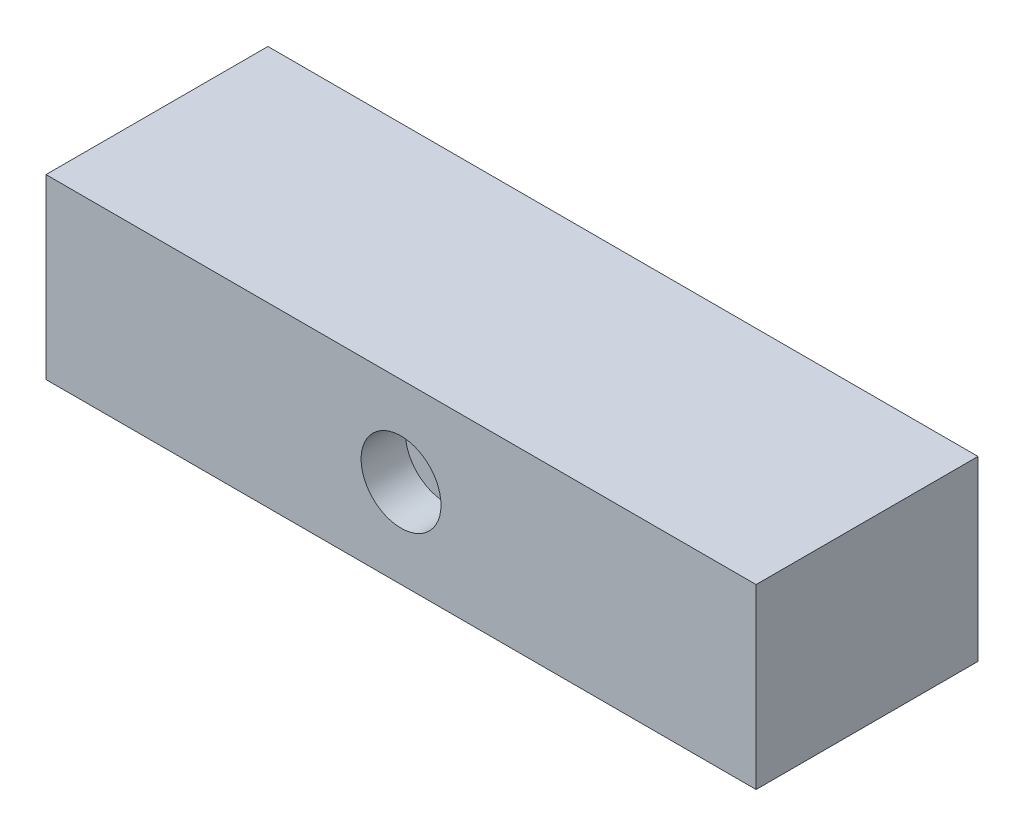
from build123d import *

# Parameters (mm, degrees)
SKETCH1_W           = 40
SKETCH1_H           = 10
BOSS_EXTRUDE1_DEPTH = 12.5
SKETCH2_R           = 2.25
CUT_EXTRUDE1_DEPTH  = 2.5


with BuildPart() as part:
    # Sketch1 → Boss-Extrude1 (new body)
    with BuildSketch(Plane.XY):
        Rectangle(SKETCH1_W, SKETCH1_H)
    extrude(amount=BOSS_EXTRUDE1_DEPTH)

    # Sketch2 → Cut-Extrude1 (cut)
    with BuildSketch(Plane.XY.offset(12.5)):
        Circle(SKETCH2_R)
    extrude(amount=-CUT_EXTRUDE1_DEPTH, mode=Mode.SUBTRACT)


solid = part.part
